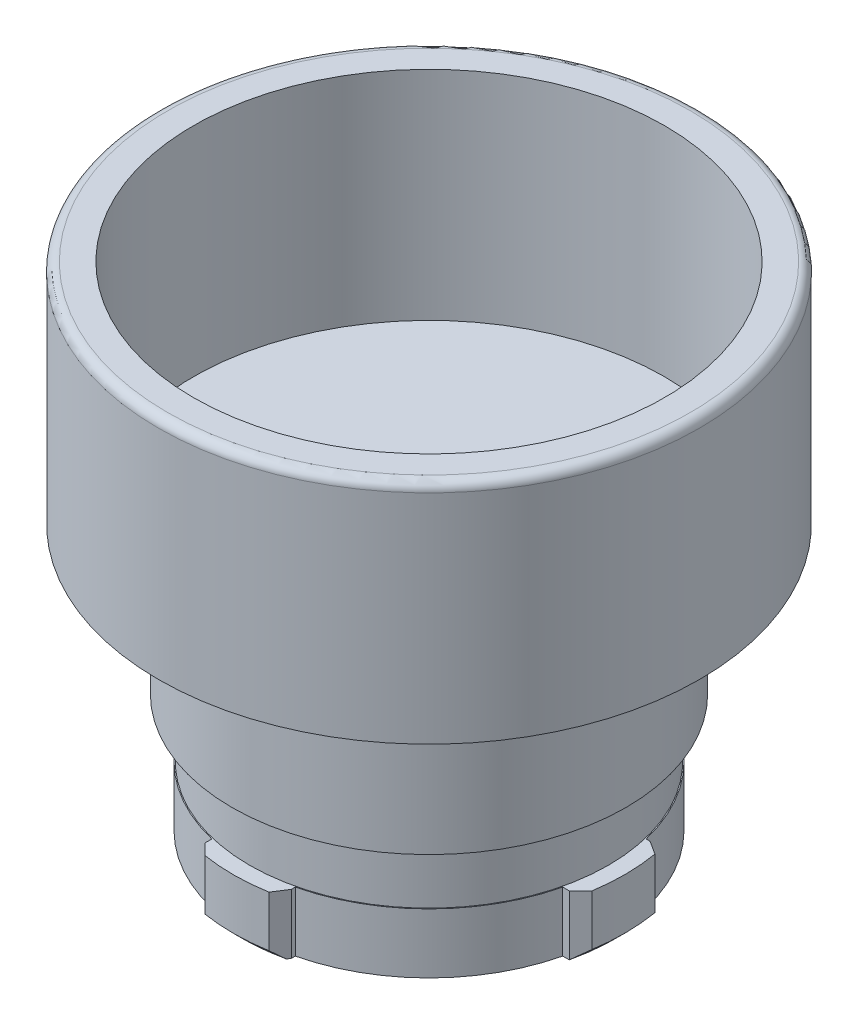
from build123d import *

# Parameters (mm, degrees)
BOSS_EXTRUDE1_DEPTH       = 3.3
M22_CLEARANCE_HOLE1_D     = 26
M22_CLEARANCE_HOLE1_DEPTH = 12
CHAMFER1_SIZE             = 0.5
FILLET1_R                 = 0.5


with BuildPart() as part:
    # Sketch1 → Boss-Extrude1 (new body)
    with BuildSketch(Plane.XZ.offset(3.3)):
        with BuildLine():
            Line((-2.3, 10.052250945), (-2.3, 9.68052168))
            ThreePointArc((-2.3, 9.68052168), (-7.035712473, 7.035712473), (-9.68052168, 2.3))
            Line((-9.68052168, 2.3), (-9.897884029, 2.3))
            Line((-9.897884029, 2.3), (-10.64555554, 1.819930558))
            ThreePointArc((-10.64555554, 1.819930558), (-10.799781696, 0.06866818), (-10.667837189, -1.684413755))
            Line((-10.667837189, -1.684413755), (-10.052250945, -2.3))
            Line((-10.052250945, -2.3), (-9.68052168, -2.3))
            ThreePointArc((-9.68052168, -2.3), (-7.035712473, -7.035712473), (-2.3, -9.68052168))
            Line((-2.3, -9.68052168), (-2.3, -9.897884029))
            Line((-2.3, -9.897884029), (-1.819930558, -10.64555554))
            ThreePointArc((-1.819930558, -10.64555554), (-0.06866818, -10.799781696), (1.684413755, -10.667837189))
            Line((1.684413755, -10.667837189), (2.3, -10.052250945))
            Line((2.3, -10.052250945), (2.3, -9.68052168))
            ThreePointArc((2.3, -9.68052168), (7.035712473, -7.035712473), (9.68052168, -2.3))
            Line((9.68052168, -2.3), (9.897884029, -2.3))
            Line((9.897884029, -2.3), (10.64555554, -1.819930558))
            ThreePointArc((10.64555554, -1.819930558), (10.799781696, -0.06866818), (10.667837189, 1.684413755))
            Line((10.667837189, 1.684413755), (10.052250945, 2.3))
            Line((10.052250945, 2.3), (9.68052168, 2.3))
            ThreePointArc((9.68052168, 2.3), (7.035712473, 7.035712473), (2.3, 9.68052168))
            Line((2.3, 9.68052168), (2.3, 9.897884029))
            Line((2.3, 9.897884029), (1.819930558, 10.64555554))
            ThreePointArc((1.819930558, 10.64555554), (0.06866818, 10.799781696), (-1.684413755, 10.667837189))
            Line((-1.684413755, 10.667837189), (-2.3, 10.052250945))
        make_face()
    extrude(amount=-BOSS_EXTRUDE1_DEPTH)

    # Sketch2 → Revolve1 (revolve)
    with BuildSketch(Plane.XY, mode=Mode.PRIVATE) as revolve1_sk:
        Polygon((14.925, 23.9), (0, 23.9), (0, 0), (9.9, 0), (9.9, 3.25), (10.875, 3.25), (10.875, 10.05), (12, 10.05), (12, 11.39), (14.925, 11.39), align=None)
    revolve(revolve1_sk.sketch.rotate(Axis((0, 23.9, 0), (0, -1, 0)), 270), axis=Axis((0, 23.9, 0), (0, -1, 0)))

    # M22 Clearance Hole1
    with Locations(Plane(origin=(0, 23.9, 0), x_dir=(1, 0, 0), z_dir=(0, 1, 0))):
        with Locations((0, 0)):
            Hole(M22_CLEARANCE_HOLE1_D / 2, depth=M22_CLEARANCE_HOLE1_DEPTH)

    # Chamfer1
    chamfer1_edges = [part.edges().sort_by_distance(p)[0] for p in [
        (-10.799781696, -3.3, 0.06866818),
        (0.06866818, -3.3, 10.799781696),
        (-0.06866818, -3.3, -10.799781696),
        (10.799781696, -3.3, -0.06866818),
    ]]
    chamfer(chamfer1_edges, length=CHAMFER1_SIZE)

    # Fillet1
    fillet1_edges = [part.edges().sort_by_distance(p)[0] for p in [
        (0, 23.9, 14.925),
    ]]
    fillet(fillet1_edges, radius=FILLET1_R)


solid = part.part
